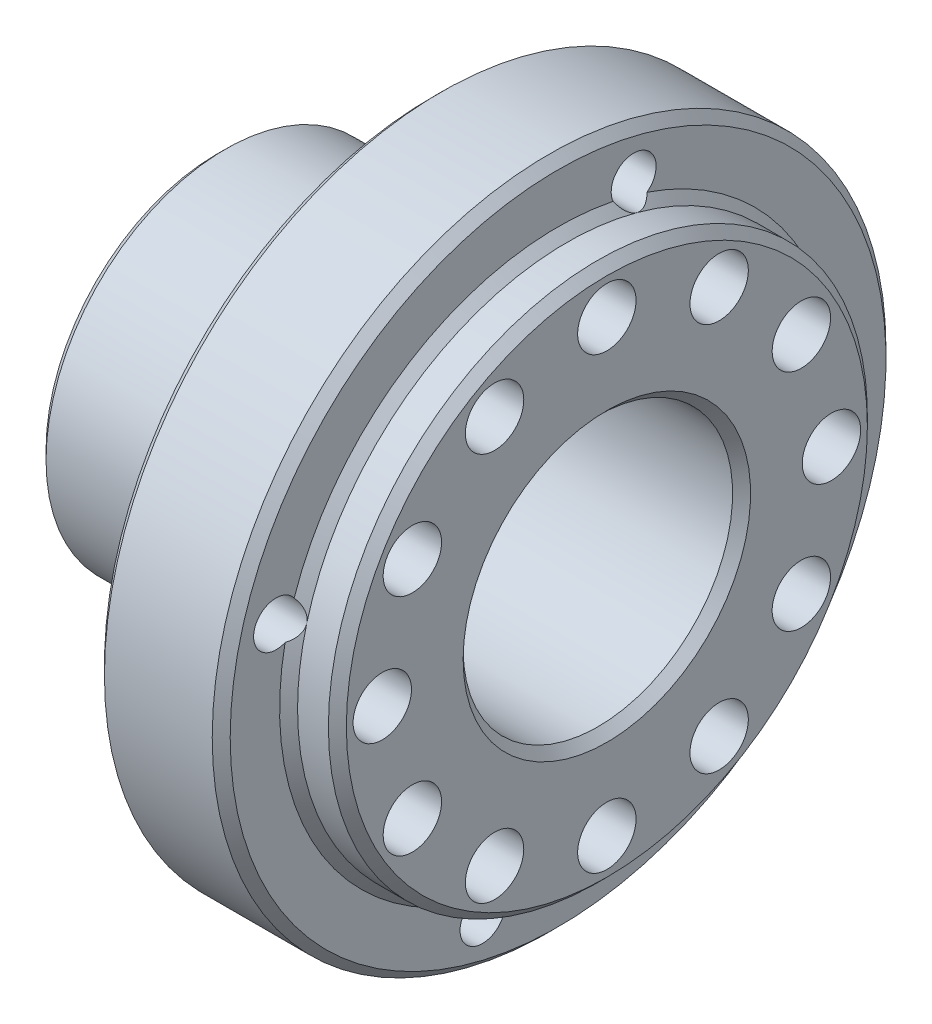
from build123d import *

# Parameters (mm, degrees)
SKETCH2_R           = 3.25
CUT_EXTRUDE1_DEPTH  = 61.713794973
BOSS_EXTRUDE1_START = -14
SKETCH4_R           = 37.5
SKETCH4_R_2         = 30
BOSS_EXTRUDE1_DEPTH = 14
CHAMFER1_SIZE       = 1
CIRPATTERN1_COUNT   = 3
CIRPATTERN1_ANGLE   = 60
M6_TAPPED_HOLE1_D   = 5


with BuildPart() as part:
    # Sketch1 → Revolve1 (revolve)
    with BuildSketch(Plane(origin=(0, 0, 0), x_dir=(1, 0, 0), z_dir=(0, 1, 0)), mode=Mode.PRIVATE) as revolve1_sk:
        Polygon((0, 20), (24, 20), (24, 30), (43.43, 30), (43.43, 15), (0, 15), align=None)
    revolve(revolve1_sk.sketch.rotate(Axis((0, 0, 0), (1, 0, 0)), 180), axis=Axis((0, 0, 0), (1, 0, 0)))

    # Sketch2 → Cut-Extrude1 (cut, through all)
    with BuildSketch(Plane(origin=(43.43, 0, 0), x_dir=(0, 0, -1), z_dir=(1, 0, 0))):
        with Locations((0, 25)):
            Circle(SKETCH2_R)
        with Locations((25, 0)):
            Circle(SKETCH2_R)
        with Locations((-25, 0)):
            Circle(SKETCH2_R)
        with Locations((0, -25)):
            Circle(SKETCH2_R)
    cut_extrude1 = extrude(amount=-CUT_EXTRUDE1_DEPTH, mode=Mode.SUBTRACT)

    # Sketch4 → Boss-Extrude1 (add)
    with BuildSketch(Plane.ZY.offset(-24).offset(BOSS_EXTRUDE1_START)):
        Circle(SKETCH4_R)
        Circle(SKETCH4_R_2, mode=Mode.SUBTRACT)
    extrude(amount=BOSS_EXTRUDE1_DEPTH)

    # Chamfer1
    chamfer1_edges = [part.edges().sort_by_distance(p)[0] for p in [
        (38, 0, -30),
        (38, 0, -37.5),
        (24, 0, -37.5),
        (0, 0, -15),
        (43.43, 0, -15),
        (43.43, 0, -30),
        (24, 0, -20),
        (0, 0, -20),
    ]]
    chamfer(chamfer1_edges, length=CHAMFER1_SIZE)

    # CirPattern1: Cut-Extrude1 ×3 about axis
    cirpattern1_axis = Axis((0, 0, 0), (-1, 0, 0))
    for i in range(1, CIRPATTERN1_COUNT):
        add(cut_extrude1.rotate(cirpattern1_axis, i * CIRPATTERN1_ANGLE / (CIRPATTERN1_COUNT - 1)), mode=Mode.SUBTRACT)

    # M6 Tapped Hole1 (through all)
    with Locations(Plane.ZY.offset(-24)):
        with Locations((-8.411618966, 31.392589354), (31.392589354, 8.411618966), (8.411618966, -31.392589354), (-31.392589354, -8.411618966)):
            Hole(M6_TAPPED_HOLE1_D / 2)


solid = part.part
